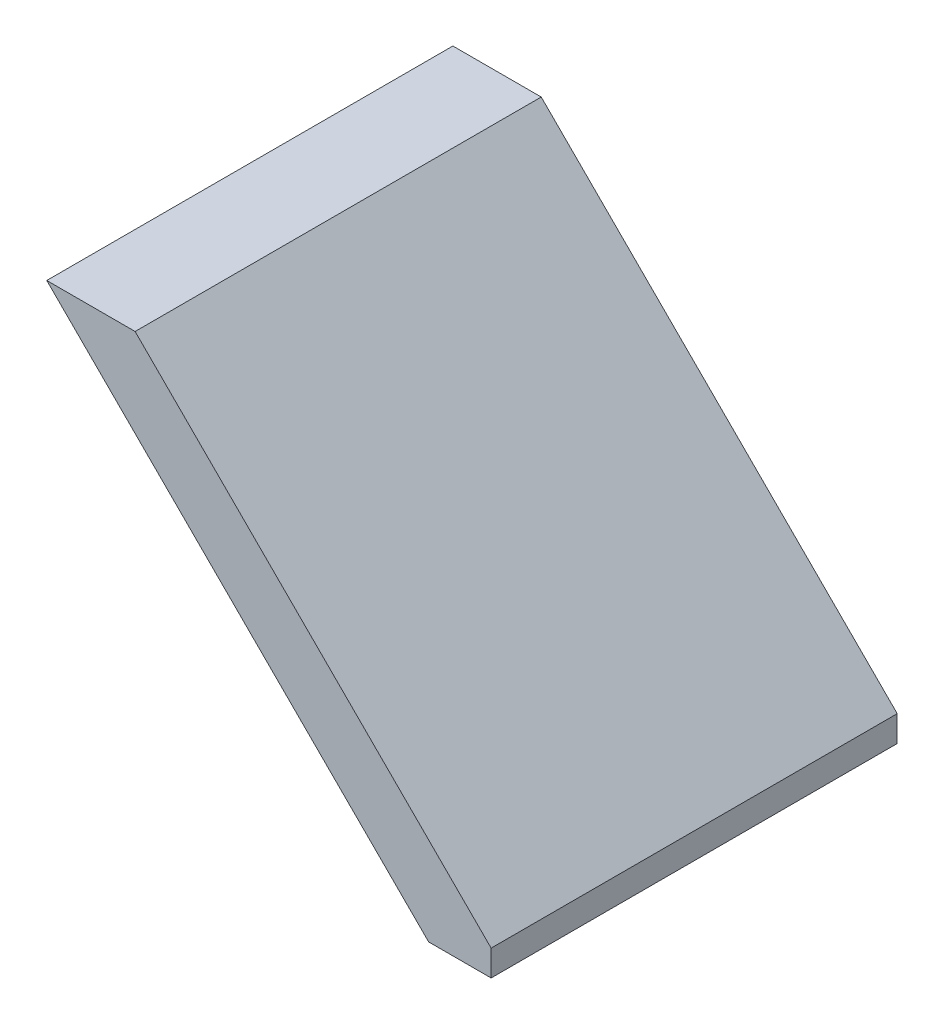
from build123d import *

# Parameters (mm, degrees)
BOSS_EXTRUDE1_DEPTH = 26


with BuildPart() as part:
    # Sketch1 → Boss-Extrude1 (new body)
    with BuildSketch(Plane.XY):
        Polygon((-79, 75), (-75, 75), (-75, 76.656854249), (-97.793145751, 99.45), (-103.45, 99.45), align=None)
    extrude(amount=-BOSS_EXTRUDE1_DEPTH)


solid = part.part
